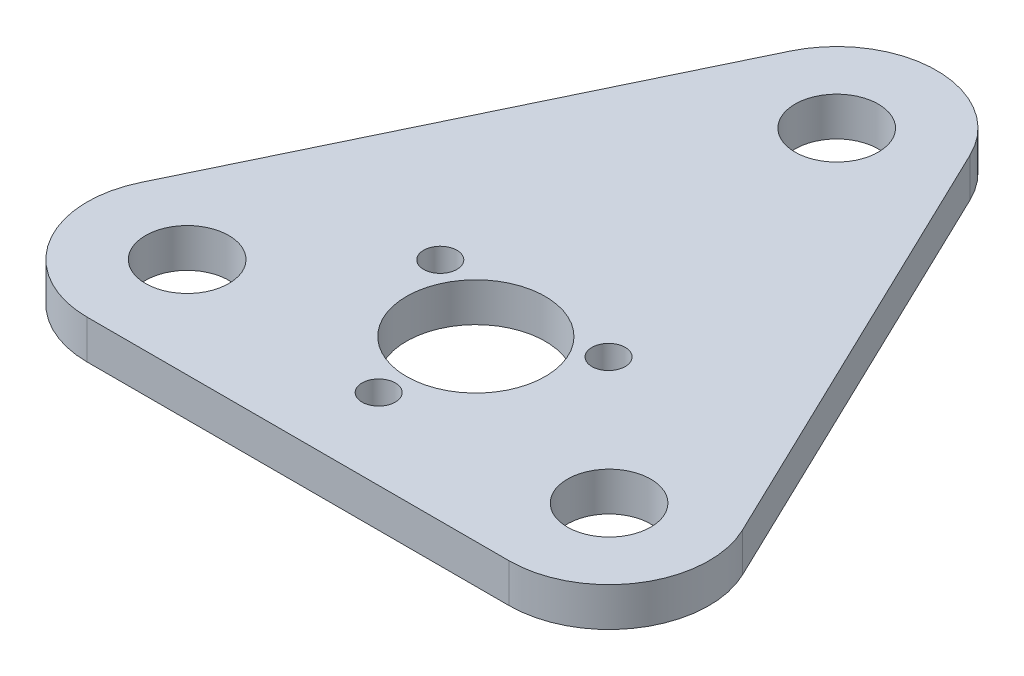
from build123d import *

# Parameters (mm, degrees)
SKETCH1_R           = 7.5
SKETCH1_R_2         = 12.5
SKETCH1_R_3         = 3
BOSS_EXTRUDE1_DEPTH = 3.5


with BuildPart() as part:
    # Sketch1 → Boss-Extrude1 (new, symmetric)
    with BuildSketch(Plane(origin=(0, 0, 0), x_dir=(1, 0, 0), z_dir=(0, 1, 0))):
        with BuildLine():
            Line((-54.221001351, 7.802506979), (-16.221001351, 86.802506979))
            ThreePointArc((-16.221001351, 86.802506979), (0, 97), (16.221001351, 86.802506979))
            Line((16.221001351, 86.802506979), (54.221001351, 7.802506979))
            ThreePointArc((54.221001351, 7.802506979), (53.238850443, -9.580054133), (38, -18))
            Line((38, -18), (-38, -18))
            ThreePointArc((-38, -18), (-53.238850443, -9.580054133), (-54.221001351, 7.802506979))
        make_face()
        with Locations(Location((-38, 0, 0), (0, 0, 270))):
            Circle(SKETCH1_R, mode=Mode.SUBTRACT)
        with Locations(Location((0, 79, 0), (0, 0, 270))):
            Circle(SKETCH1_R, mode=Mode.SUBTRACT)
        with Locations(Location((38, 0, 0), (0, 0, 270))):
            Circle(SKETCH1_R, mode=Mode.SUBTRACT)
        with Locations(Location((0, 14, 0), (0, 0, 270))):
            Circle(SKETCH1_R_2, mode=Mode.SUBTRACT)
        with Locations(Location((-15.155444566, 22.75, 0), (0, 0, 270))):
            Circle(SKETCH1_R_3, mode=Mode.SUBTRACT)
        with Locations(Location((15.155444566, 22.75, 0), (0, 0, 270))):
            Circle(SKETCH1_R_3, mode=Mode.SUBTRACT)
        with Locations(Location((0, -3.5, 0), (0, 0, 270))):
            Circle(SKETCH1_R_3, mode=Mode.SUBTRACT)
    extrude(amount=BOSS_EXTRUDE1_DEPTH, both=True)


solid = part.part
